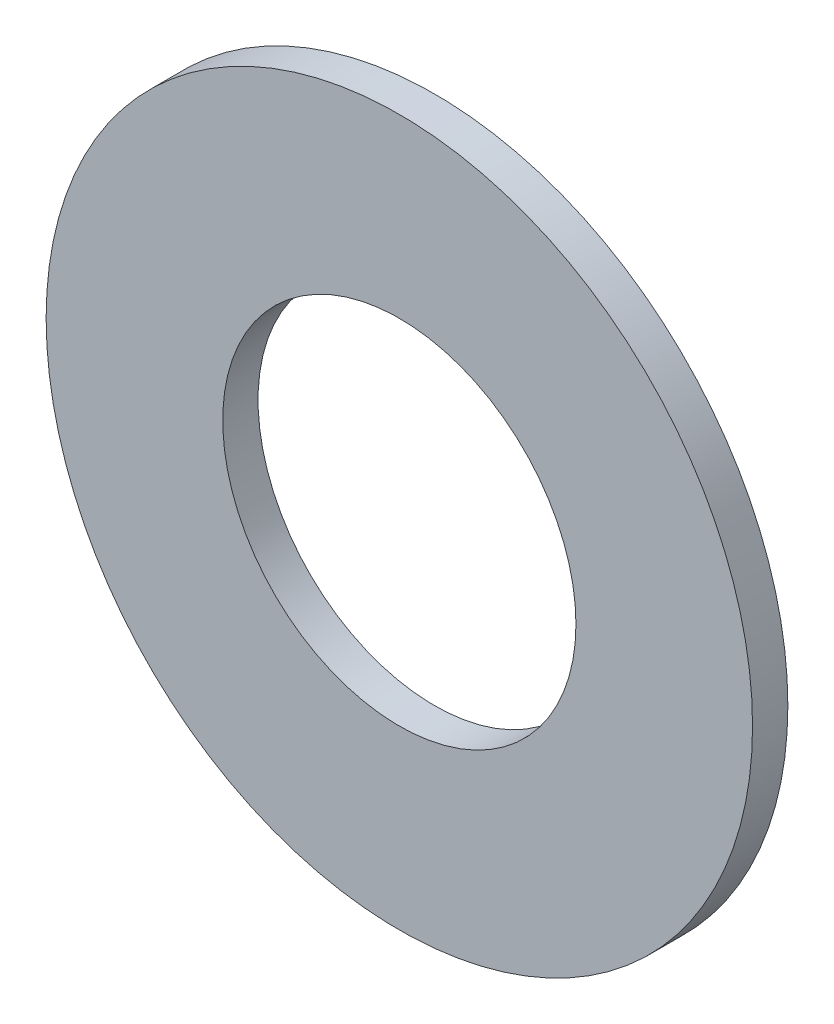
from build123d import *

# Parameters (mm, degrees)
SKETCH_1_R      = 10
SKETCH_1_R_2    = 5
EXTRUDE_1_DEPTH = 1


with BuildPart() as part:
    # 草图1 → 凸台-拉伸1 (new body)
    with BuildSketch(Plane.XY):
        Circle(SKETCH_1_R)
        Circle(SKETCH_1_R_2, mode=Mode.SUBTRACT)
    extrude(amount=EXTRUDE_1_DEPTH)


solid = part.part
